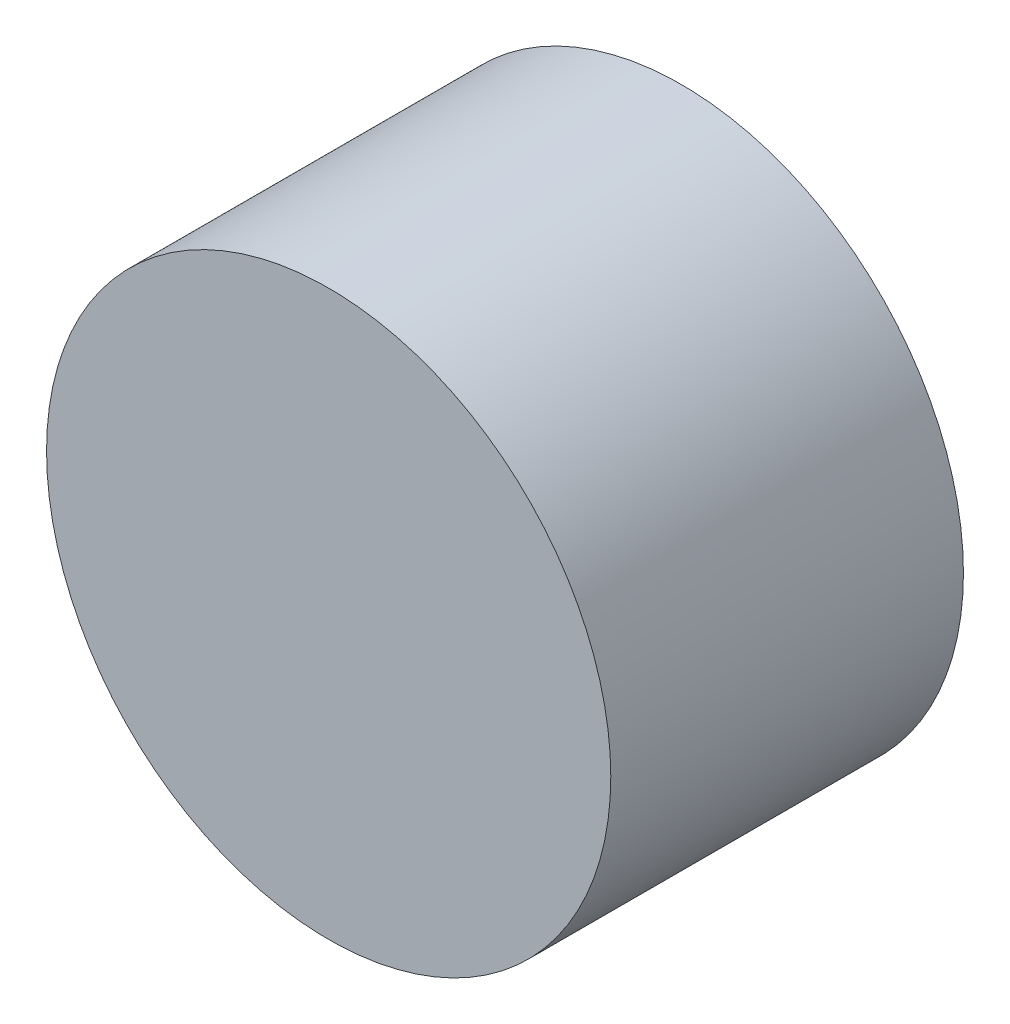
from build123d import *

# Parameters (mm, degrees)
SKETCH_1_R      = 4
EXTRUDE_1_DEPTH = 5


with BuildPart() as part:
    # 草图1 → 凸台-拉伸1 (new body)
    with BuildSketch(Plane.XY):
        Circle(SKETCH_1_R)
    extrude(amount=EXTRUDE_1_DEPTH)


solid = part.part
